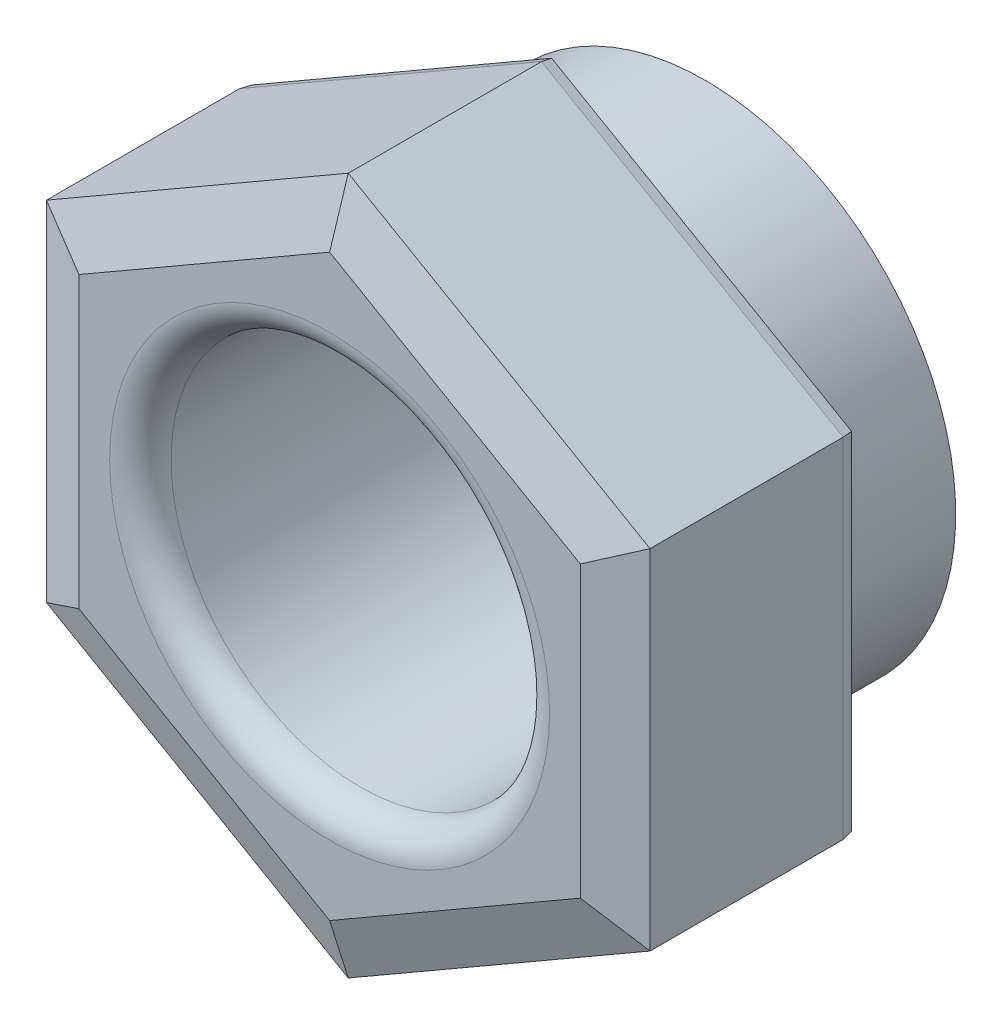
from build123d import *
from OCP.BRepFilletAPI import BRepFilletAPI_MakeChamfer

# Parameters (mm, degrees)
RESSALTO_EXTRUS_O1_DEPTH = 18.35
ESBO_O2_R                = 9.25
CORTE_EXTRUS_O1_DEPTH    = 30.058016679
ESBO_O3_R                = 19.09752109
ESBO_O3_R_2              = 12.25
CORTE_EXTRUS_O2_DEPTH    = 7.5
FILETE1_R                = 2
CHANFRO1_SIZE            = 0.5
CHANFRO1_SIZE2           = 0.08816349
FILETE2_R                = 1
CHANFRO3_SIZE            = 2.5
CHANFRO3_SIZE2           = 0.909925586
FILETE3_R                = 1.5


with BuildPart() as part:
    # Esboço1 → Ressalto-extrusão1 (new body)
    with BuildSketch(Plane.XY):
        Polygon((0, -17.031832941), (14.75, -8.515916471), (14.75, 8.515916471), (0, 17.031832941), (-14.75, 8.515916471), (-14.75, -8.515916471), align=None)
    extrude(amount=RESSALTO_EXTRUS_O1_DEPTH)

    # Esboço2 → Corte-extrusão1 (cut, through all)
    with BuildSketch(Plane.XY.offset(18.35)):
        Circle(ESBO_O2_R)
    extrude(amount=-CORTE_EXTRUS_O1_DEPTH, mode=Mode.SUBTRACT)

    # Esboço3 → Corte-extrusão2 (cut)
    with BuildSketch(Plane(origin=(0, 0, 0), x_dir=(-1, 0, 0), z_dir=(0, 0, -1))):
        Circle(ESBO_O3_R)
        Circle(ESBO_O3_R_2, mode=Mode.SUBTRACT)
    extrude(amount=-CORTE_EXTRUS_O2_DEPTH, mode=Mode.SUBTRACT)

    # Filete1
    filete1_edges = [part.edges().sort_by_distance(p)[0] for p in [
        (-9.25, 0, 0),
    ]]
    fillet(filete1_edges, radius=FILETE1_R)

    # Chanfro1: one chamfer whose edges measure the first distance from different faces: ONE call of the kernel's chamfer builder (chamfer() names one face for all edges)
    chanfro1_edges_1 = [part.edges().sort_by_distance(p)[0] for p in [
        (-14.75, 0, 7.5),
    ]]
    chanfro1_side_1 = [part.faces().sort_by_distance(p)[0] for p in [
        (-14.75, 0, 12.925),
    ]]
    chanfro1_edges_2 = [part.edges().sort_by_distance(p)[0] for p in [
        (7.375, -12.773874706, 7.5),
    ]]
    chanfro1_side_2 = [part.faces().sort_by_distance(p)[0] for p in [
        (7.375, -12.773874706, 12.925),
    ]]
    chanfro1_edges_3 = [part.edges().sort_by_distance(p)[0] for p in [
        (-7.375, -12.773874706, 7.5),
    ]]
    chanfro1_side_3 = [part.faces().sort_by_distance(p)[0] for p in [
        (-7.375, -12.773874706, 12.925),
    ]]
    chanfro1_edges_4 = [part.edges().sort_by_distance(p)[0] for p in [
        (-7.375, 12.773874706, 7.5),
    ]]
    chanfro1_side_4 = [part.faces().sort_by_distance(p)[0] for p in [
        (-7.375, 12.773874706, 12.925),
    ]]
    chanfro1_edges_5 = [part.edges().sort_by_distance(p)[0] for p in [
        (7.375, 12.773874706, 7.5),
    ]]
    chanfro1_side_5 = [part.faces().sort_by_distance(p)[0] for p in [
        (7.375, 12.773874706, 12.925),
    ]]
    chanfro1_edges_6 = [part.edges().sort_by_distance(p)[0] for p in [
        (14.75, 0, 7.5),
    ]]
    chanfro1_side_6 = [part.faces().sort_by_distance(p)[0] for p in [
        (14.75, 0, 12.925),
    ]]
    chanfro1 = BRepFilletAPI_MakeChamfer(part.part.solid().wrapped)
    for e in chanfro1_edges_1:
        chanfro1.Add(CHANFRO1_SIZE, CHANFRO1_SIZE2, e.wrapped, chanfro1_side_1[0].wrapped)  # the first distance lies on this face
    for e in chanfro1_edges_2:
        chanfro1.Add(CHANFRO1_SIZE, CHANFRO1_SIZE2, e.wrapped, chanfro1_side_2[0].wrapped)  # the first distance lies on this face
    for e in chanfro1_edges_3:
        chanfro1.Add(CHANFRO1_SIZE, CHANFRO1_SIZE2, e.wrapped, chanfro1_side_3[0].wrapped)  # the first distance lies on this face
    for e in chanfro1_edges_4:
        chanfro1.Add(CHANFRO1_SIZE, CHANFRO1_SIZE2, e.wrapped, chanfro1_side_4[0].wrapped)  # the first distance lies on this face
    for e in chanfro1_edges_5:
        chanfro1.Add(CHANFRO1_SIZE, CHANFRO1_SIZE2, e.wrapped, chanfro1_side_5[0].wrapped)  # the first distance lies on this face
    for e in chanfro1_edges_6:
        chanfro1.Add(CHANFRO1_SIZE, CHANFRO1_SIZE2, e.wrapped, chanfro1_side_6[0].wrapped)  # the first distance lies on this face
    add(Compound.cast(chanfro1.Shape()), mode=Mode.REPLACE)

    # Filete2
    filete2_edges = [part.edges().sort_by_distance(p)[0] for p in [
        (12.25, 0, 7.5),
    ]]
    fillet(filete2_edges, radius=FILETE2_R)

    # Chanfro3
    chanfro3_edges = [part.edges().sort_by_distance(p)[0] for p in [
        (14.75, 0, 18.35),
        (7.375, 12.773874706, 18.35),
        (-7.375, 12.773874706, 18.35),
        (-14.75, 0, 18.35),
        (-7.375, -12.773874706, 18.35),
        (7.375, -12.773874706, 18.35),
    ]]
    chanfro3_side = [part.faces().sort_by_distance(p)[0] for p in [
        (7.149690028, -12.383626387, 18.35),
    ]]
    chamfer(chanfro3_edges, length=CHANFRO3_SIZE, length2=CHANFRO3_SIZE2, reference=chanfro3_side[0])

    # Filete3
    filete3_edges = [part.edges().sort_by_distance(p)[0] for p in [
        (-9.25, 0, 18.35),
    ]]
    fillet(filete3_edges, radius=FILETE3_R)


solid = part.part
